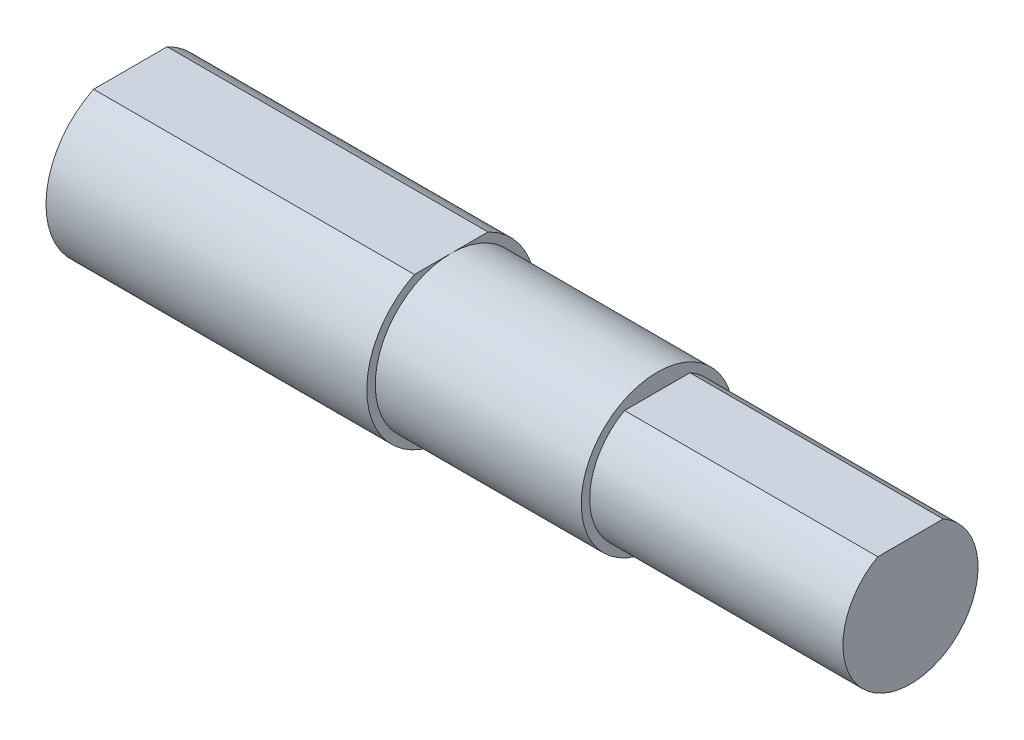
from build123d import *

# Parameters (mm, degrees)
EXTRUDE_1_DEPTH = 19
SKETCH_2_R      = 4.5
EXTRUDE_2_DEPTH = 12.2
EXTRUDE_3_DEPTH = 15


with BuildPart() as part:
    # 草图1 → 拉伸1 (new body)
    with BuildSketch(Plane(origin=(0, 0, 0), x_dir=(0, 0, -1), z_dir=(1, 0, 0))):
        with BuildLine():
            Line((-2.179449472, 4.5), (2.179449472, 4.5))
            ThreePointArc((2.179449472, 4.5), (0, -5), (-2.179449472, 4.5))
        make_face()
    extrude(amount=EXTRUDE_1_DEPTH)

    # 草图2 → 拉伸2 (add)
    with BuildSketch(Plane(origin=(19, 0, 0), x_dir=(0, 0, -1), z_dir=(1, 0, 0))):
        with Locations(Location((0, 0, 0), (0, 0, 90))):
            Circle(SKETCH_2_R)
    extrude(amount=EXTRUDE_2_DEPTH)

    # 草图3 → 拉伸3 (add)
    with BuildSketch(Plane(origin=(31.2, 0, 0), x_dir=(0, 0, -1), z_dir=(1, 0, 0))):
        with BuildLine():
            Line((-1.936491673, 3.5), (1.936491673, 3.5))
            ThreePointArc((1.936491673, 3.5), (0, -4), (-1.936491673, 3.5))
        make_face()
    extrude(amount=EXTRUDE_3_DEPTH)


solid = part.part
